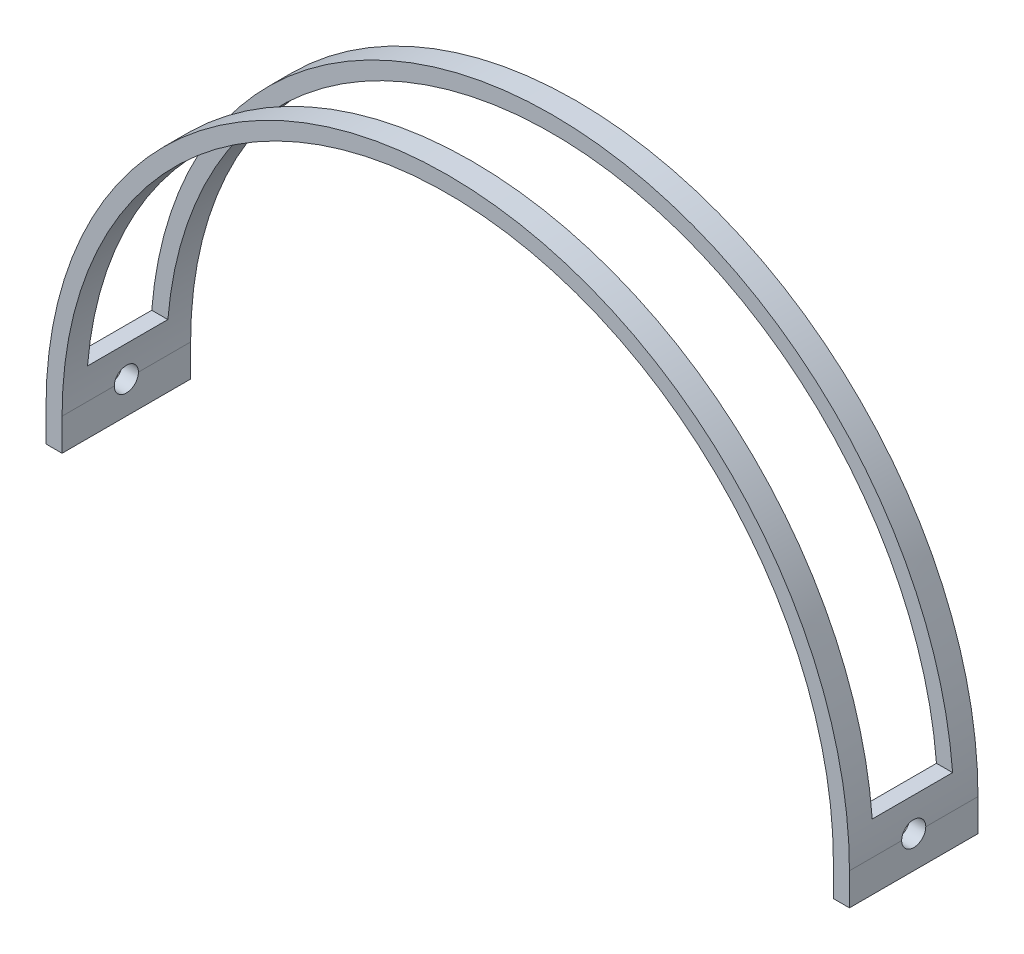
from build123d import *

# Parameters (mm, degrees)
BOSS_EXTRUDE1_DEPTH = 80
SKETCH2_R           = 7.5
CUT_EXTRUDE2_DEPTH  = 565.71231614
SKETCH4_W           = 50
SKETCH4_H           = 230
CUT_EXTRUDE3_DEPTH  = 565.712316287


with BuildPart() as part:
    # Sketch1 → Boss-Extrude1 (new body)
    with BuildSketch(Plane.XY):
        with BuildLine():
            Line((-250, 0), (-250, -20))
            Line((-250, -20), (-240, -20))
            Line((-240, -20), (-240, 0))
            ThreePointArc((-240, 0), (0, 240), (240, 0))
            Line((240, 0), (240, -20))
            Line((240, -20), (250, -20))
            Line((250, -20), (250, 0))
            ThreePointArc((250, 0), (0, 250), (-250, 0))
        make_face()
    extrude(amount=BOSS_EXTRUDE1_DEPTH)

    # Sketch2 → Cut-Extrude2 (cut, through all)
    with BuildSketch(Plane(origin=(250, 0, 0), x_dir=(0, 0, -1), z_dir=(1, 0, 0))):
        with Locations((-40, 0)):
            Circle(SKETCH2_R)
    extrude(amount=-CUT_EXTRUDE2_DEPTH, mode=Mode.SUBTRACT)

    # Sketch4 → Cut-Extrude3 (cut, through all)
    with BuildSketch(Plane(origin=(250, 0, 0), x_dir=(0, 0, -1), z_dir=(1, 0, 0))):
        with Locations((-40, 135)):
            Rectangle(SKETCH4_W, SKETCH4_H)
    extrude(amount=-CUT_EXTRUDE3_DEPTH, mode=Mode.SUBTRACT)


solid = part.part
